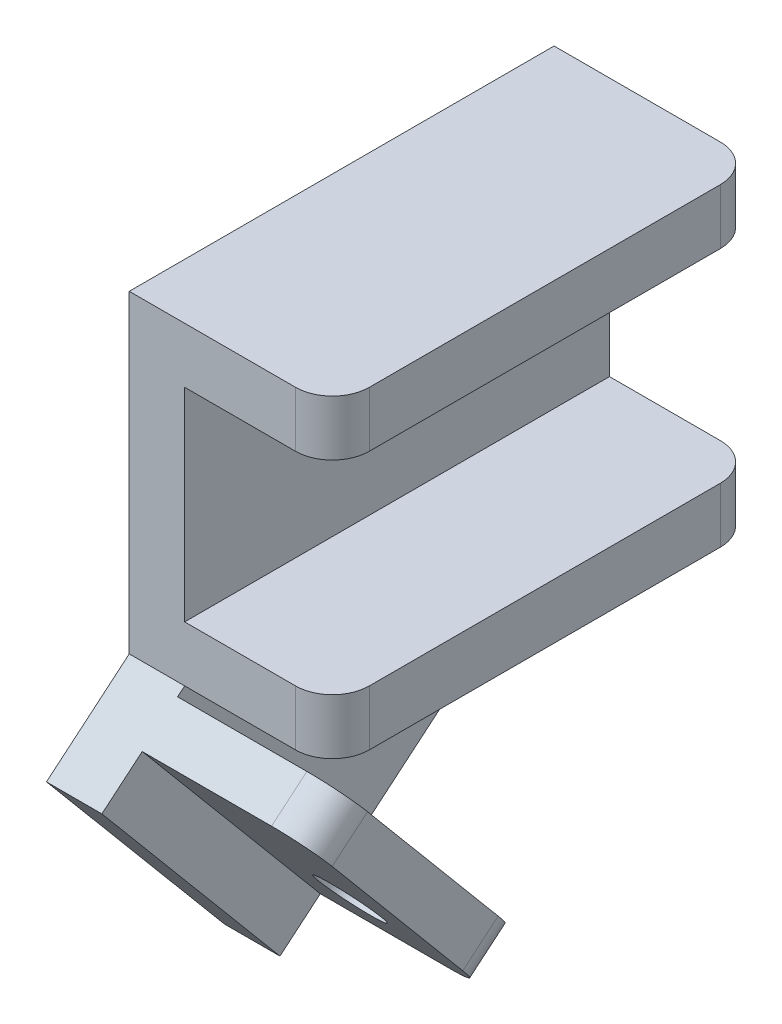
from build123d import *

# Parameters (mm, degrees)
BOSS_EXTRUDE1_DEPTH = 23
BOSS_EXTRUDE3_DEPTH = 3
BOSS_EXTRUDE4_DEPTH = 9
SKETCH4_R           = 1.7
CUT_EXTRUDE1_DEPTH  = 32.237159536
SKETCH5_W           = 3
SKETCH5_H           = 15
BOSS_EXTRUDE5_DEPTH = 2.85
SKETCH6_R           = 1.6
CUT_EXTRUDE2_DEPTH  = 42.890865789
FILLET1_R           = 2


with BuildPart() as part:
    # Sketch1 → Boss-Extrude1 (new body)
    with BuildSketch(Plane.XY):
        Polygon((0, 0), (-8, 0), (-8, -11), (0, -11), (0, -14), (-11, -14), (-11, 3), (0, 3), align=None)
    extrude(amount=BOSS_EXTRUDE1_DEPTH)

    # Sketch2 → Boss-Extrude3 (add)
    with BuildSketch(Plane.ZY.offset(11)):
        Polygon((23, -14), (0, -14), (-0.138768188, -14.165377487), (15.656319184, -27.419029476), (25.298133329, -15.928362829), align=None)
    extrude(amount=-BOSS_EXTRUDE3_DEPTH)

    # Sketch3 → Boss-Extrude4 (add)
    with BuildSketch(Plane(origin=(-8, 0, 0), x_dir=(0, 0, -1), z_dir=(1, 0, 0))):
        Polygon((-25.298133329, -15.928362829), (-23.383022222, -14.321393805), (-13.741208076, -25.812060452), (-15.656319184, -27.419029476), align=None)
    extrude(amount=BOSS_EXTRUDE4_DEPTH)

    # Sketch4 → Cut-Extrude1 (cut, through all)
    with BuildSketch(Plane(origin=(0, -17.431145721, 20.773630536), x_dir=(-1, 0, 0), z_dir=(0, 0.6427876096865378, -0.7660444431189795))):
        with Locations(Location((3.5, -6.440507181, 0), (0, 0, 90))):
            Circle(SKETCH4_R)
    extrude(amount=-CUT_EXTRUDE1_DEPTH, mode=Mode.SUBTRACT)

    # Sketch5 → Boss-Extrude5 (add)
    with BuildSketch(Plane(origin=(0, -19.038114745, 22.688741644), x_dir=(1, 0, 0), z_dir=(0, -0.6427876096865379, 0.7660444431189792))):
        with Locations((-9.5, -3.440507181)):
            Rectangle(SKETCH5_W, SKETCH5_H)
    extrude(amount=BOSS_EXTRUDE5_DEPTH)

    # Sketch6 → Cut-Extrude2 (cut, through all)
    with BuildSketch(Plane.ZY.offset(11)):
        with Locations((6, -5)):
            Circle(SKETCH6_R)
    extrude(amount=-CUT_EXTRUDE2_DEPTH, mode=Mode.SUBTRACT)

    # Fillet1
    fillet1_edges = [part.edges().sort_by_distance(p)[0] for p in [
        (0, 1.5, 0),
        (0, -12.5, 23),
        (0, 1.5, 23),
        (1, -26.615544964, 14.69876363),
        (1, -15.124878317, 24.340577775),
        (0, -12.5, 0),
    ]]
    fillet(fillet1_edges, radius=FILLET1_R)


solid = part.part
